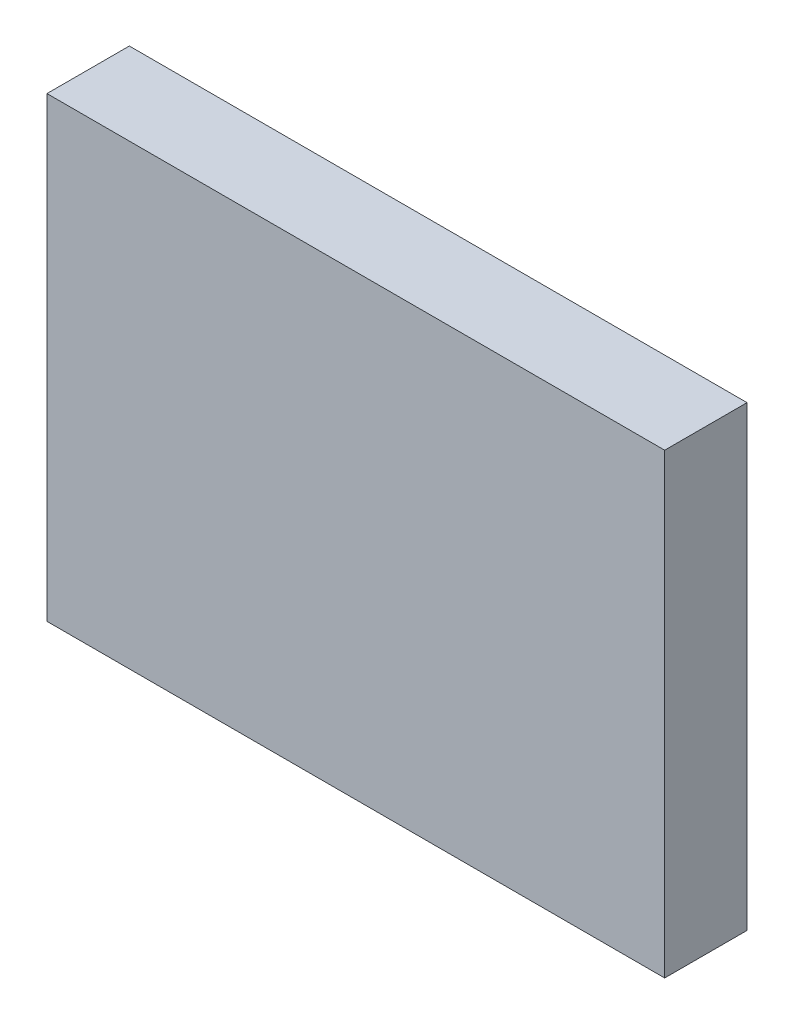
from build123d import *

# Parameters (mm, degrees)
CROQUIS1_W              = 150
CROQUIS1_H              = 111
SALIENTE_EXTRUIR1_DEPTH = 20


with BuildPart() as part:
    # Croquis1 → Saliente-Extruir1 (new body)
    with BuildSketch(Plane.XY):
        with Locations((0.208859393, -10.255312869)):
            Rectangle(CROQUIS1_W, CROQUIS1_H)
    extrude(amount=SALIENTE_EXTRUIR1_DEPTH)


solid = part.part
